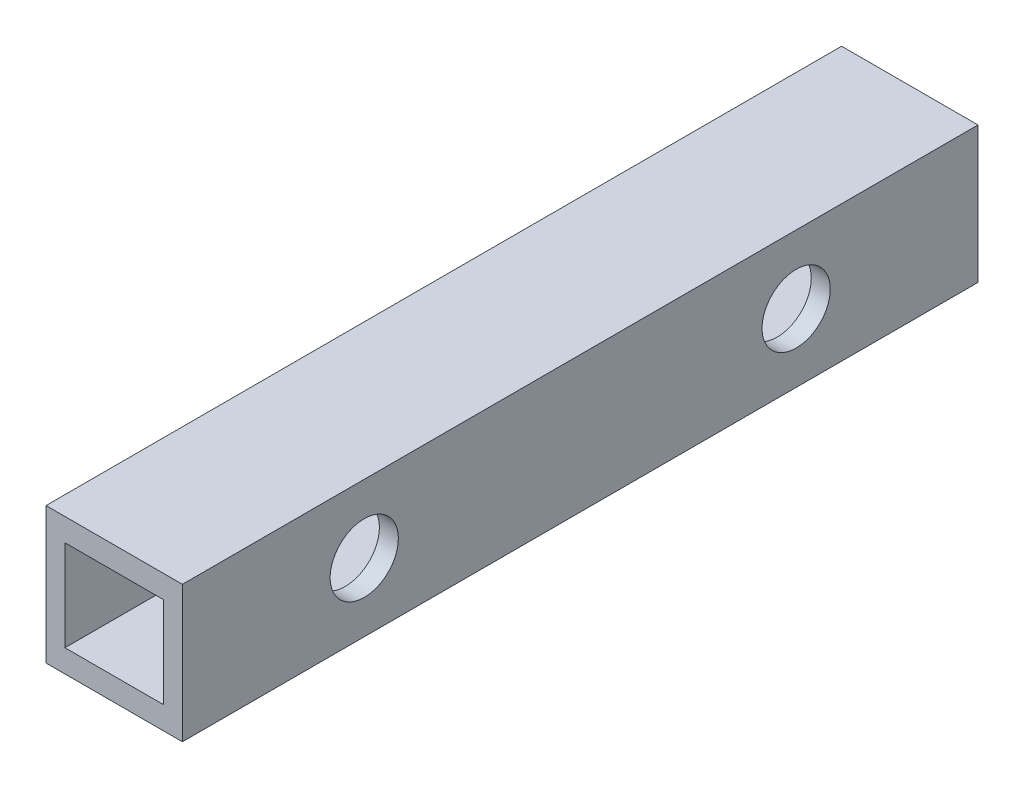
from build123d import *

# Parameters (mm, degrees)
SKETCH1_W           = 60
SKETCH1_H           = 60
BOSS_EXTRUDE1_DEPTH = 350
SKETCH3_W           = 43.312374626
SKETCH3_H           = 40
CUT_EXTRUDE2_DEPTH  = 375
SKETCH4_R           = 15
CUT_EXTRUDE3_DEPTH  = 375


with BuildPart() as part:
    # Sketch1 → Boss-Extrude1 (new body)
    with BuildSketch(Plane.XY):
        Rectangle(SKETCH1_W, SKETCH1_H)
    extrude(amount=BOSS_EXTRUDE1_DEPTH)

    # Sketch3 → Cut-Extrude2 (cut)
    with BuildSketch(Plane(origin=(0, 0, 0), x_dir=(-1, 0, 0), z_dir=(0, 0, -1))):
        Rectangle(SKETCH3_W, SKETCH3_H)
    extrude(amount=-CUT_EXTRUDE2_DEPTH, mode=Mode.SUBTRACT)

    # Sketch4 → Cut-Extrude3 (cut)
    with BuildSketch(Plane(origin=(30, 0, 0), x_dir=(0, 0, -1), z_dir=(1, 0, 0))):
        with Locations((-80, 0)):
            Circle(SKETCH4_R)
    cut_extrude3 = extrude(amount=-CUT_EXTRUDE3_DEPTH, mode=Mode.SUBTRACT)

    # Mirror1: Cut-Extrude3 across plane
    add(cut_extrude3.mirror(Plane(origin=(0, 0, 175), x_dir=(1, 0, 0), z_dir=(0, 0, -1))), mode=Mode.SUBTRACT)


solid = part.part
